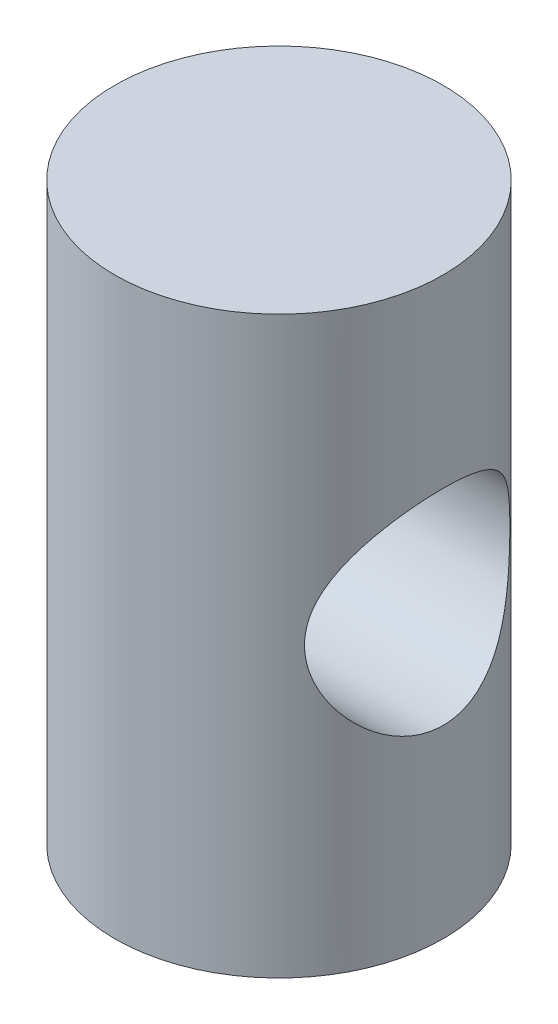
from build123d import *

# Parameters (mm, degrees)
SKETCH1_R           = 4
BOSS_EXTRUDE1_DEPTH = 7
SKETCH2_R           = 2.5
CUT_EXTRUDE1_DEPTH  = 7


with BuildPart() as part:
    # Sketch1 → Boss-Extrude1 (new, symmetric)
    with BuildSketch(Plane(origin=(0, 0, 0), x_dir=(1, 0, 0), z_dir=(0, 1, 0))):
        with Locations(Location((0, 0, 0), (0, 0, 270))):
            Circle(SKETCH1_R)
    extrude(amount=BOSS_EXTRUDE1_DEPTH, both=True)

    # Sketch2 → Cut-Extrude1 (cut, symmetric)
    with BuildSketch(Plane(origin=(0, 0, 0), x_dir=(0, 0, -1), z_dir=(1, 0, 0))):
        Circle(SKETCH2_R)
    extrude(amount=CUT_EXTRUDE1_DEPTH, both=True, mode=Mode.SUBTRACT)


solid = part.part
